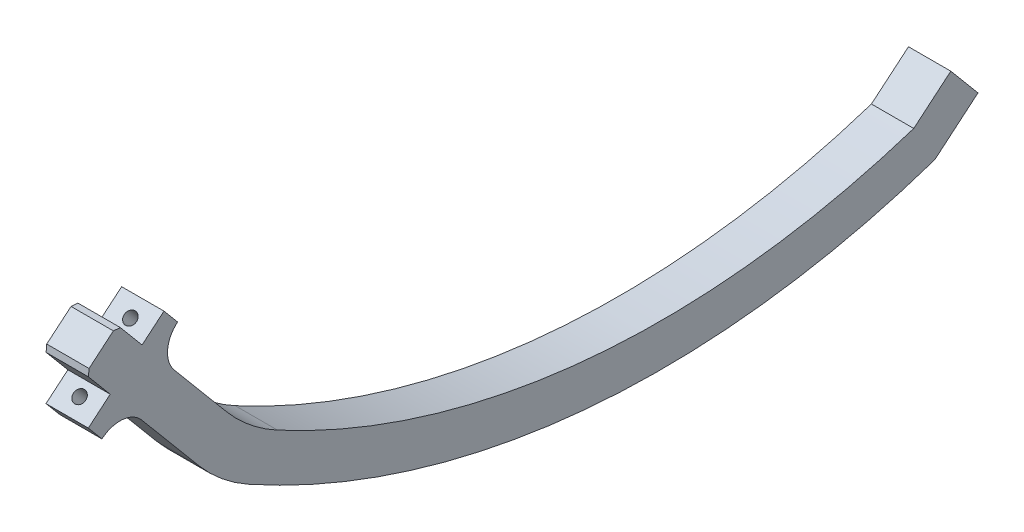
from build123d import *

# Parameters (mm, degrees)
AUFSATZ_LINEAR_AUSTRAGEN1_DEPTH = 12
AUFSATZ_LINEAR_AUSTRAGEN3_DEPTH = 12
AUFSATZ_LINEAR_AUSTRAGEN4_DEPTH = 12
SCHNITT_LINEAR_AUSTRAGEN1_DEPTH = 254.175024926
VERRUNDUNG1_R                   = 50
SKIZZE9_W                       = 12
SKIZZE9_H                       = 12
AUFSATZ_LINEAR_AUSTRAGEN6_DEPTH = 11
AUFSATZ_LINEAR_AUSTRAGEN7_DEPTH = 12
SKIZZE11_R                      = 1.75
SCHNITT_LINEAR_AUSTRAGEN3_DEPTH = 10
SKIZZE12_R                      = 2.75
SCHNITT_LINEAR_AUSTRAGEN4_DEPTH = 3.6
FASE1_SIZE                      = 1.5
SCHNITT_LINEAR_AUSTRAGEN8_DEPTH = 254.549622303


with BuildPart() as part:
    # Skizze1 → Aufsatz-Linear austragen1 (new body)
    with BuildSketch(Plane(origin=(0, 0, 0), x_dir=(0, 0, -1), z_dir=(1, 0, 0))):
        with BuildLine():
            Line((-240, 65), (-230.735708163, 72.773663864))
            ThreePointArc((-230.735708163, 72.773663864), (-123.944567763, 17.242039243), (-3.735818811, 23.403668612))
            Line((-3.735818811, 23.403668612), (0, 12))
            ThreePointArc((0, 12), (-127.247502729, 5.681119716), (-240, 65))
        make_face()
    extrude(amount=AUFSATZ_LINEAR_AUSTRAGEN1_DEPTH)

    # Skizze4 → Aufsatz-Linear austragen3 (add)
    with BuildSketch(Plane(origin=(0, 0, 0), x_dir=(0, 0, -1), z_dir=(1, 0, 0))):
        with BuildLine():
            Line((-3.735818811, 23.403668612), (6.769031275, 32.218284445))
            Line((6.769031275, 32.218284445), (14.482482591, 23.025751128))
            Line((14.482482591, 23.025751128), (2.225771501, 12.741149373))
            ThreePointArc((2.225771501, 12.741149373), (1.113785782, 12.367871772), (0, 12))
            Line((0, 12), (-3.735818811, 23.403668612))
        make_face()
    extrude(amount=AUFSATZ_LINEAR_AUSTRAGEN3_DEPTH)

    # Skizze5 → Aufsatz-Linear austragen4 (add)
    with BuildSketch(Plane(origin=(12, 0, 0), x_dir=(0, 0, -1), z_dir=(1, 0, 0))):
        Polygon((-231.662517154, 71.995978781), (-222.469983836, 79.709430098), (-210.899806862, 65.920630121), (-192.948331238, 44.526894555), (-220.092340179, 58.207178805), align=None)
    extrude(amount=-AUFSATZ_LINEAR_AUSTRAGEN4_DEPTH)

    # Skizze6 → Schnitt-Linear austragen1 (cut, through all)
    with BuildSketch(Plane(origin=(12, 0, 0), x_dir=(0, 0, -1), z_dir=(1, 0, 0))):
        Polygon((-231.662517154, 71.995978781), (-199.510648028, 33.678873242), (-204.367668784, 29.603348917), (-240, 65), align=None)
    extrude(amount=-SCHNITT_LINEAR_AUSTRAGEN1_DEPTH, mode=Mode.SUBTRACT)

    # Verrundung1
    verrundung1_edges = [part.edges().sort_by_distance(p)[0] for p in [
        (6, 44.526894555, 192.948331238),
        (6, 35.285406895, 200.858689823),
    ]]
    fillet(verrundung1_edges, radius=VERRUNDUNG1_R)

    # Skizze9 → Aufsatz-Linear austragen6 (add)
    with BuildSketch(Plane(origin=(0, 156.320496136, 131.168470653), x_dir=(1, 0, 0), z_dir=(0, 0.7660444431189836, 0.6427876096865328))):
        with Locations((6, -125.185660837)):
            Rectangle(SKIZZE9_W, SKIZZE9_H)
    extrude(amount=AUFSATZ_LINEAR_AUSTRAGEN6_DEPTH)

    # Skizze10 → Aufsatz-Linear austragen7 (add)
    with BuildSketch(Plane.ZY):
        with BuildLine():
            Line((231.662517154, 71.995978781), (237.790872699, 66.853677904))
            Line((237.790872699, 66.853677904), (233.93414704, 62.257411245))
            ThreePointArc((233.93414704, 62.257411245), (228.094600221, 64.098613285), (222.663490618, 61.271356578))
            Line((222.663490618, 61.271356578), (231.662517154, 71.995978781))
        make_face()
        with BuildLine():
            Line((213.470957301, 68.984807894), (222.469983836, 79.709430098))
            Line((222.469983836, 79.709430098), (216.341628291, 84.851730975))
            Line((216.341628291, 84.851730975), (212.484902633, 80.255464316))
            ThreePointArc((212.484902633, 80.255464316), (215.31215934, 74.824354713), (213.470957301, 68.984807894))
        make_face()
    extrude(amount=-AUFSATZ_LINEAR_AUSTRAGEN7_DEPTH)

    # Skizze11 → Schnitt-Linear austragen3 (cut)
    with BuildSketch(Plane(origin=(0, 156.320496136, 131.168470653), x_dir=(1, 0, 0), z_dir=(0, 0.7660444431189826, 0.642787609686534))):
        with Locations(Location((6, -115.785660837, 0), (0, 0, 270))):
            Circle(SKIZZE11_R)
        with Locations(Location((6, -134.585660837, 0), (0, 0, 270))):
            Circle(SKIZZE11_R)
    extrude(amount=-SCHNITT_LINEAR_AUSTRAGEN3_DEPTH, mode=Mode.SUBTRACT)

    # Skizze12 → Schnitt-Linear austragen4 (cut)
    with BuildSketch(Plane(origin=(0, 148.660051704, 124.740594556), x_dir=(1, 0, 0), z_dir=(0, 0.7660444431189826, 0.642787609686534))):
        with Locations((6, -134.585660837)):
            Circle(SKIZZE12_R)
        with Locations((6, -115.785660837)):
            Circle(SKIZZE12_R)
    extrude(amount=SCHNITT_LINEAR_AUSTRAGEN4_DEPTH, mode=Mode.SUBTRACT)

    # Fase1
    fase1_edges = [part.edges().sort_by_distance(p)[0] for p in [
        (6, 88.135918972, 229.540647543),
        (6, 80.422467656, 238.73318086),
    ]]
    chamfer(fase1_edges, length=FASE1_SIZE)

    # Skizze16 → Schnitt-Linear austragen8 (cut, through all)
    with BuildSketch(Plane(origin=(12, 0, 0), x_dir=(0, 0, -1), z_dir=(1, 0, 0))):
        Polygon((-222.469983836, 79.709430098), (-222.546588281, 79.645151337), (-228.717349334, 86.999177991), (-228.640744889, 87.063456752), align=None)
        Polygon((-237.833278207, 79.350005435), (-231.662517154, 71.995978781), (-231.585912709, 72.060257542), (-237.756673762, 79.414284196), align=None)
    extrude(amount=-SCHNITT_LINEAR_AUSTRAGEN8_DEPTH, mode=Mode.SUBTRACT)


solid = part.part
